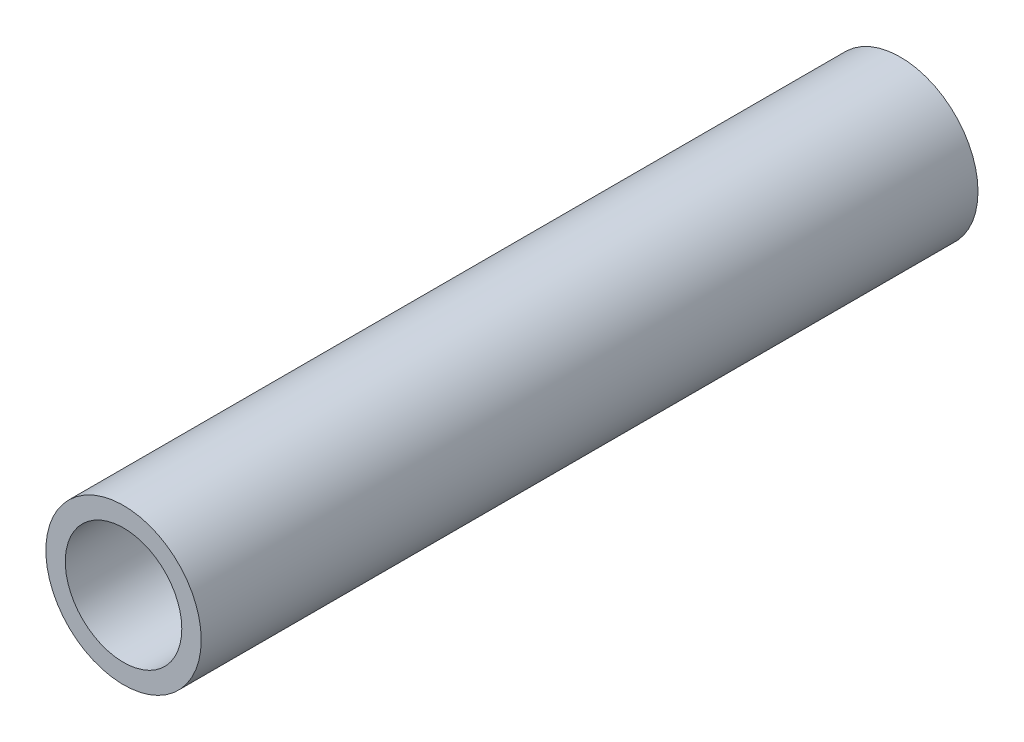
from build123d import *

# Parameters (mm, degrees)
SKETCH_1_R      = 4
SKETCH_1_R_2    = 3
EXTRUDE_1_DEPTH = 40


with BuildPart() as part:
    # 草图1 → 凸台-拉伸1 (new body)
    with BuildSketch(Plane.XY):
        Circle(SKETCH_1_R)
        Circle(SKETCH_1_R_2, mode=Mode.SUBTRACT)
    extrude(amount=EXTRUDE_1_DEPTH)


solid = part.part
